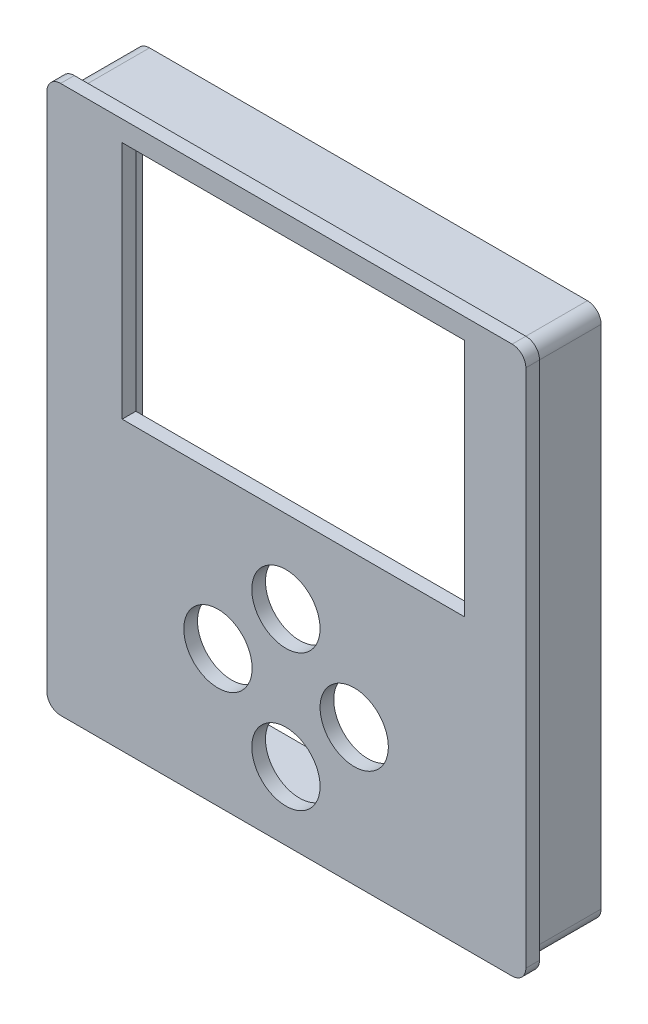
from build123d import *

# Parameters (mm, degrees)
SKETCH1_R           = 6.338085432
SKETCH1_W           = 63.5
SKETCH1_H           = 44.45
BOSS_EXTRUDE1_DEPTH = 2.54
BOSS_EXTRUDE2_DEPTH = 12.7
CUT_EXTRUDE1_REACH  = 136.65
SKETCH3_W           = 12.7
SKETCH3_H           = 12.7


with BuildPart() as part:
    # Sketch1 → Boss-Extrude1 (new body)
    with BuildSketch(Plane.XY):
        with BuildLine():
            Line((88.9, 99.06), (88.9, 2.54))
            ThreePointArc((88.9, 2.54), (88.156051224, 0.743948776), (86.36, 0))
            Line((86.36, 0), (2.54, 0))
            ThreePointArc((2.54, 0), (0.743948776, 0.743948776), (0, 2.54))
            Line((0, 2.54), (0, 99.06))
            ThreePointArc((0, 99.06), (0.743948776, 100.856051224), (2.54, 101.6))
            Line((2.54, 101.6), (86.36, 101.6))
            ThreePointArc((86.36, 101.6), (88.156051224, 100.856051224), (88.9, 99.06))
        make_face()
        with Locations((31.75, 25.352341726)):
            Circle(SKETCH1_R, mode=Mode.SUBTRACT)
        with Locations((44.366598021, 38.028512589)):
            Circle(SKETCH1_R, mode=Mode.SUBTRACT)
        with Locations((57.042768884, 25.352341726)):
            Circle(SKETCH1_R, mode=Mode.SUBTRACT)
        with Locations((44.366598021, 12.676170863)):
            Circle(SKETCH1_R, mode=Mode.SUBTRACT)
        with Locations((45.72, 75.565)):
            Rectangle(SKETCH1_W, SKETCH1_H, mode=Mode.SUBTRACT)
    extrude(amount=BOSS_EXTRUDE1_DEPTH)

    # Sketch2 → Boss-Extrude2 (add)
    with BuildSketch(Plane(origin=(0, 0, 0), x_dir=(-1, 0, 0), z_dir=(0, 0, -1))):
        with BuildLine():
            Line((-3.81, 100.33), (-85.09, 100.33))
            ThreePointArc((-85.09, 100.33), (-86.886051224, 99.586051224), (-87.63, 97.79))
            Line((-87.63, 97.79), (-87.63, 3.81))
            ThreePointArc((-87.63, 3.81), (-86.886051224, 2.013948776), (-85.09, 1.27))
            Line((-85.09, 1.27), (-3.81, 1.27))
            ThreePointArc((-3.81, 1.27), (-2.013948776, 2.013948776), (-1.27, 3.81))
            Line((-1.27, 3.81), (-1.27, 97.79))
            ThreePointArc((-1.27, 97.79), (-2.013948776, 99.586051224), (-3.81, 100.33))
        make_face()
        with BuildLine():
            ThreePointArc((-83.82, 99.06), (-85.616051224, 98.316051224), (-86.36, 96.52))
            Line((-86.36, 96.52), (-86.36, 5.08))
            ThreePointArc((-86.36, 5.08), (-85.616051224, 3.283948776), (-83.82, 2.54))
            Line((-83.82, 2.54), (-5.08, 2.54))
            ThreePointArc((-5.08, 2.54), (-3.283948776, 3.283948776), (-2.54, 5.08))
            Line((-2.54, 5.08), (-2.54, 96.52))
            ThreePointArc((-2.54, 96.52), (-3.283948776, 98.316051224), (-5.08, 99.06))
            Line((-5.08, 99.06), (-83.82, 99.06))
        make_face(mode=Mode.SUBTRACT)
    extrude(amount=BOSS_EXTRUDE2_DEPTH)

    # Sketch3 → Cut-Extrude1 (cut, up to next)
    with BuildSketch(Plane.XZ.offset(-1.27), mode=Mode.PRIVATE) as cut_extrude1_sk1:
        with Locations((78.74, -6.35)):
            Rectangle(SKETCH3_W, SKETCH3_H)
    cut_extrude1_tool1 = extrude(cut_extrude1_sk1.sketch, amount=-CUT_EXTRUDE1_REACH, mode=Mode.PRIVATE) & part.part
    add(cut_extrude1_tool1.solids().sort_by_distance((78.74, 1.27, -6.35))[0], mode=Mode.SUBTRACT)


solid = part.part
